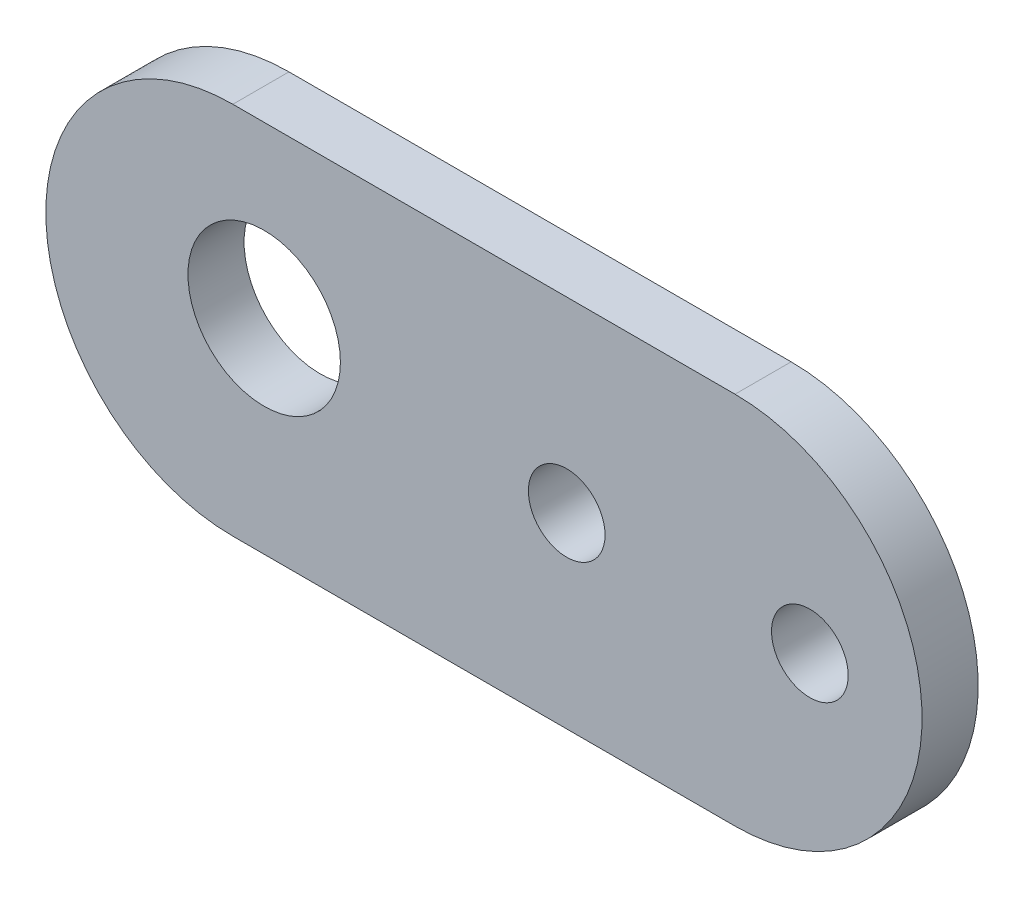
from build123d import *

# Parameters (mm, degrees)
BOSS_EXTRUDE1_DEPTH = 1.5
SKETCH3_R           = 2.05
CUT_EXTRUDE1_DEPTH  = 26.646259474
SKETCH4_R           = 4.075
CUT_EXTRUDE2_DEPTH  = 3


with BuildPart() as part:
    # Sketch2 → Boss-Extrude1 (new, symmetric)
    with BuildSketch(Plane.XY):
        with BuildLine():
            Line((-13.425, 10), (13.425, 10))
            ThreePointArc((13.425, 10), (23.425, 0), (13.425, -10))
            Line((13.425, -10), (-13.425, -10))
            ThreePointArc((-13.425, -10), (-23.425, 0), (-13.425, 10))
        make_face()
    extrude(amount=BOSS_EXTRUDE1_DEPTH, both=True)

    # Sketch3 → Cut-Extrude1 (cut, through all)
    with BuildSketch(Plane.XY.offset(1.5)):
        with Locations((4.425, 0)):
            Circle(SKETCH3_R)
        with Locations((17.425, 0)):
            Circle(SKETCH3_R)
    extrude(amount=-CUT_EXTRUDE1_DEPTH, mode=Mode.SUBTRACT)

    # Sketch4 → Cut-Extrude2 (cut)
    with BuildSketch(Plane.XY.offset(1.5)):
        with Locations((-11.75, 0.925)):
            Circle(SKETCH4_R)
    extrude(amount=-CUT_EXTRUDE2_DEPTH, mode=Mode.SUBTRACT)


solid = part.part
